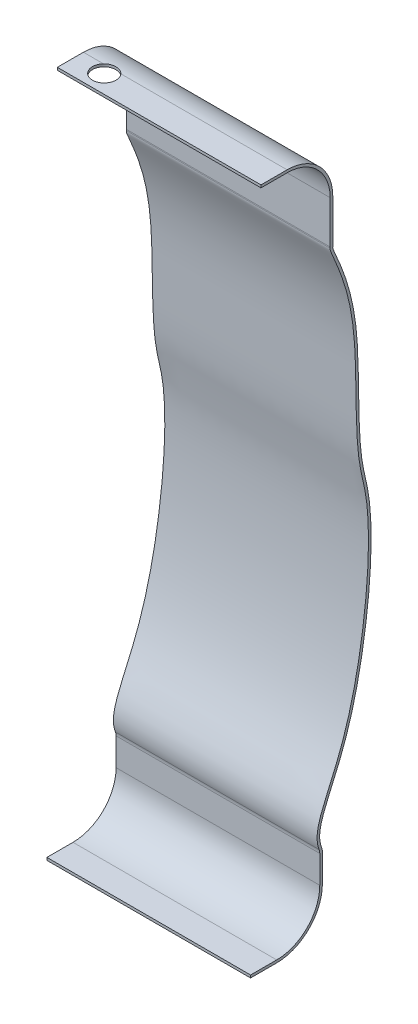
from build123d import *

# Parameters (mm, degrees)
BOSS_EXTRUDE1_DEPTH        = 15.6
M1_6_CLEARANCE_HOLE1_D     = 1.8
M1_6_CLEARANCE_HOLE1_DEPTH = 1.58
M1_6_CLEARANCE_HOLE1_TIP   = 0.540774557


with BuildPart() as part:
    # Sketch2 → Boss-Extrude1 (new body)
    with BuildSketch(Plane(origin=(0, 0, 0), x_dir=(0, 0, -1), z_dir=(1, 0, 0))):
        with BuildLine():
            Line((0.797662791, 52.21), (2.797662791, 52.21))
            ThreePointArc((2.797662791, 52.21), (5.272536525, 51.184873734), (6.297662791, 48.71))
            Line((6.297662791, 48.71), (6.297662791, 45.440524187))
            ThreePointArc((6.297662791, 45.440524187), (6.296428214, 45.390848939), (6.292727531, 45.341296346))
            add(Edge.make_bspline(
                [(6.292727531, 45.341296346), (6.259607091, 45.009161928), (8.745493857, 41.190833381), (8.054511063, 31.347743897), (9.795982079, 25.321611421), (8.06869407, 10.856960565), (4.790349055, 7.659193658), (5.434687, 5.964954418)],
                knots=[0.006984382, 0.006984382, 0.006984382, 0.006984382, 0.231915871, 0.40888799, 0.457654803, 0.719584003, 0.994356133, 0.994356133, 0.994356133, 0.994356133], degree=3))
            ThreePointArc((5.434687, 5.964954418), (5.483536222, 5.790193697), (5.5, 5.609482602))
            Line((5.5, 5.609482602), (5.5, 3.5))
            ThreePointArc((5.5, 3.5), (4.474873734, 1.025126266), (2, 0))
            Line((2, 0), (0, 0))
            Line((0, 0), (0, 0.2))
            Line((0, 0.2), (2, 0.2))
            ThreePointArc((2, 0.2), (4.333452378, 1.166547622), (5.3, 3.5))
            Line((5.3, 3.5), (5.3, 5.609482602))
            ThreePointArc((5.3, 5.609482602), (5.286828978, 5.754051478), (5.2477496, 5.893860055))
            add(Edge.make_bspline(
                [(6.093714583, 45.361141914), (6.082576514, 45.249448468), (6.152908978, 45.057838302), (6.339148063, 44.617374325), (6.61619349, 43.986650028), (7.045564878, 42.895653504), (7.621541213, 41.074265041), (8.029969954, 38.145708791), (8.062229465, 35.228512546), (8.103347105, 32.935279673), (8.178252313, 31.303640847), (8.340584582, 29.822307079), (8.638092952, 28.592417748), (8.891327512, 27.33724374), (9.018786932, 25.833913335), (9.045034686, 24.178571286), (8.95220636, 21.822326787), (8.623424374, 18.736336869), (7.971215037, 15.195463106), (7.136251155, 12.285584549), (6.243218334, 10.130417301), (5.232490187, 7.936234492), (4.933223021, 6.720884562), (5.2477496, 5.893860055)],
                knots=[0.006984382, 0.006984382, 0.006984382, 0.006984382, 0.037839749, 0.068695116, 0.099550484, 0.130405851, 0.192116585, 0.25382732, 0.315538054, 0.346393421, 0.377248789, 0.408104156, 0.438959523, 0.46981489, 0.500670257, 0.531525625, 0.562380992, 0.624091726, 0.685802461, 0.747513195, 0.809223929, 0.870934664, 0.994356133, 0.994356133, 0.994356133, 0.994356133], degree=3))
            ThreePointArc((6.093714583, 45.361141914), (6.09667513, 45.400783988), (6.097662791, 45.440524187))
            Line((6.097662791, 45.440524187), (6.097662791, 48.71))
            ThreePointArc((6.097662791, 48.71), (5.131115169, 51.043452378), (2.797662791, 52.01))
            Line((2.797662791, 52.01), (0.797662791, 52.01))
            Line((0.797662791, 52.01), (0.797662791, 52.21))
        make_face()
    extrude(amount=BOSS_EXTRUDE1_DEPTH)

    # M1.6 Clearance Hole1
    with Locations(Plane(origin=(0, 52.21, 0), x_dir=(1, 0, 0), z_dir=(0, 1, 0))):
        with Locations((2.20093171, 2.190571018)):
            Hole(M1_6_CLEARANCE_HOLE1_D / 2, depth=M1_6_CLEARANCE_HOLE1_DEPTH)
            with Locations((0, 0, -(M1_6_CLEARANCE_HOLE1_DEPTH + M1_6_CLEARANCE_HOLE1_TIP / 2))):  # 118° drill point
                Cone(0, M1_6_CLEARANCE_HOLE1_D / 2, M1_6_CLEARANCE_HOLE1_TIP, mode=Mode.SUBTRACT)


solid = part.part
